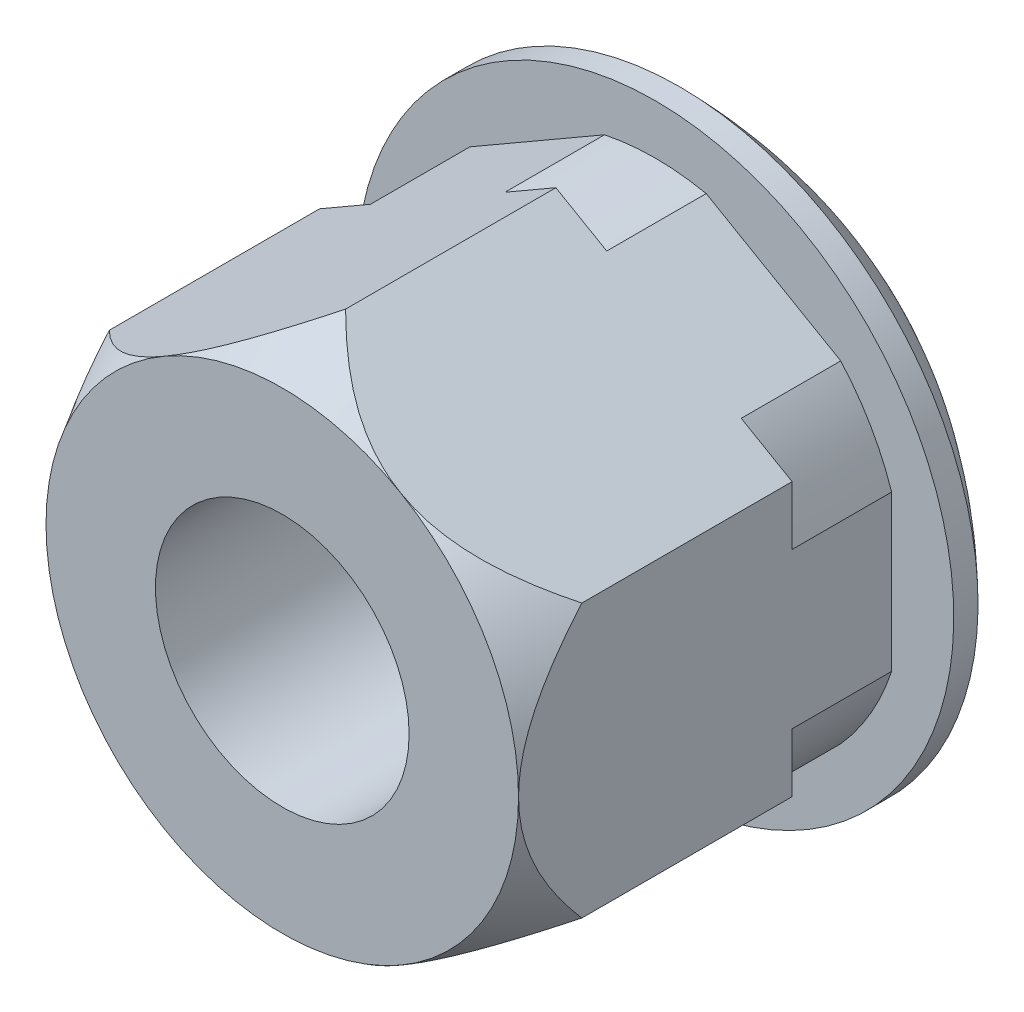
from build123d import *

# Parameters (mm, degrees)
EXTRUDE_1_DEPTH     = 15
SKETCH_2_OUTSIDE_W  = 27.534
SKETCH_2_OUTSIDE_H  = 30.474
SKETCH_2_OUTSIDE_R  = 10
CUT_EXTRUDE_1_DEPTH = 4
SKETCH_4_OUTSIDE_W  = 65.322
SKETCH_4_OUTSIDE_H  = 65.322
SKETCH_4_OUTSIDE_R  = 9.5
CUT_EXTRUDE_2_DEPTH = 27.229754265
CUT_EXTRUDE_2_DRAFT = -30
HOLE_WIZARD_M12_1_D = 10.2


with BuildPart() as part:
    # 草图1 → 凸台-拉伸1 (new body)
    with BuildSketch(Plane.XY):
        Polygon((0, 10.969655115), (-9.5, 5.484827557), (-9.5, -5.484827557), (0, -10.969655115), (9.5, -5.484827557), (9.5, 5.484827557), align=None)
    extrude(amount=-EXTRUDE_1_DEPTH)

    # 草图2 outside → 切除-拉伸1 (cut)
    with BuildSketch(Plane(origin=(0, 0, -15), x_dir=(-1, 0, 0), z_dir=(0, 0, -1))):
        Rectangle(SKETCH_2_OUTSIDE_W, SKETCH_2_OUTSIDE_H)
        Circle(SKETCH_2_OUTSIDE_R, mode=Mode.SUBTRACT)
    extrude(amount=-CUT_EXTRUDE_1_DEPTH, mode=Mode.SUBTRACT)

    # 草图3 → 旋转1 (revolve)
    with BuildSketch(Plane(origin=(0, 0, 0), x_dir=(0, 0, -1), z_dir=(1, 0, 0))):
        with BuildLine():
            Line((15, 0), (15, 12))
            Line((15, 12), (15.975879312, 12))
            ThreePointArc((15.975879312, 12), (18.176229373, 9.387763735), (20, 6.5))
            Line((20, 6.5), (20, 0))
            Line((20, 0), (15, 0))
        make_face()
    revolve(axis=Axis((0, 0, -20), (0, 0, 1)))


with BuildPart() as cut_extrude_2_tool:
    # 草图4 outside → 切除-拉伸2 (with draft: the straight prism first)
    with BuildSketch(Plane.XY):
        Rectangle(SKETCH_4_OUTSIDE_W, SKETCH_4_OUTSIDE_H)
        Circle(SKETCH_4_OUTSIDE_R, mode=Mode.SUBTRACT)
    extrude(amount=-CUT_EXTRUDE_2_DEPTH)
    # 切除-拉伸2: the draft: its side faces are tilted about the plane it starts from
    cut_extrude_2_sides = [cut_extrude_2_tool.faces().sort_by_distance(p)[0] for p in [
        (0, -32.661, -13.614877132),
        (32.661, 0, -13.614877132),
        (0, 32.661, -13.614877132),
        (-32.661, 0, -13.614877132),
        (-9.5, 0, -13.614877132),
    ]]
    draft(cut_extrude_2_sides, Plane.XY, CUT_EXTRUDE_2_DRAFT)


with BuildPart() as part_1:
    add(part.part)

    # 切除-拉伸2: cut by cut_extrude_2_tool
    add(cut_extrude_2_tool.part, mode=Mode.SUBTRACT)

    # M12 螺纹孔1 (through all)
    with Locations(Plane.XY):
        with Locations((0, 0)):
            Hole(HOLE_WIZARD_M12_1_D / 2)


solid = part_1.part
